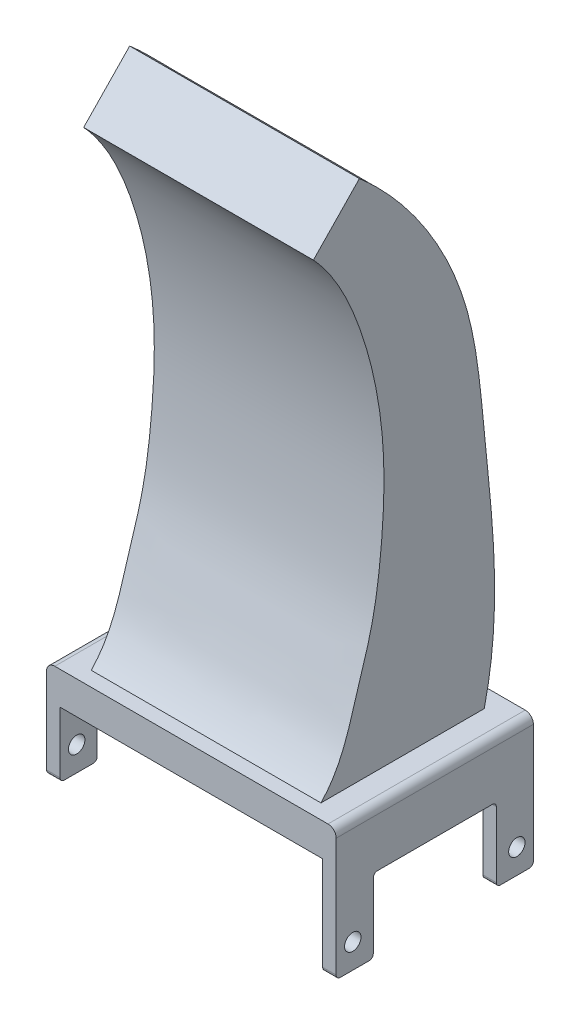
from build123d import *

# Parameters (mm, degrees)
SKETCH1_W                = 35.3
SKETCH1_H                = 24.04
BOSS_EXTRUDE1_DEPTH      = 4
SKETCH2_R                = 1
BOSS_EXTRUDE2_DEPTH      = 1.65
SKETCH3_R                = 1
BOSS_EXTRUDE3_DEPTH      = 1.65
FILLET1_R                = 1
FILLET2_R                = 1
FILLET3_R                = 0.5
BOSS_EXTRUDE4_DEPTH      = 14
BOSS_EXTRUDE4_DEPTH_BACK = 14


with BuildPart() as part:
    # Sketch1 → Boss-Extrude1 (new body)
    with BuildSketch(Plane(origin=(0, 0, 0), x_dir=(1, 0, 0), z_dir=(0, 1, 0))):
        Rectangle(SKETCH1_W, SKETCH1_H)
    extrude(amount=BOSS_EXTRUDE1_DEPTH)

    # Sketch2 → Boss-Extrude2 (add)
    # profile 1 of 2: a face of its own
    with BuildSketch(Plane(origin=(17.65, 0, 0), x_dir=(0, 0, -1), z_dir=(1, 0, 0))):
        Polygon((-7.5, -2.95), (0, -2.95), (0, 0), (-12.02, 0), (-12.02, -11.95), (-7.5, -11.95), align=None)
        with Locations((-10, -8.95)):
            Circle(SKETCH2_R, mode=Mode.SUBTRACT)
    # profile 2 of 2: a face of its own
    with BuildSketch(Plane(origin=(17.65, 0, 0), x_dir=(0, 0, -1), z_dir=(1, 0, 0))):
        Polygon((7.5, -2.95), (7.5, -11.95), (12.02, -11.95), (12.02, 0), (0, 0), (0, -2.95), align=None)
        with Locations((10, -8.95)):
            Circle(SKETCH2_R, mode=Mode.SUBTRACT)
    extrude(amount=-BOSS_EXTRUDE2_DEPTH)

    # Sketch3 → Boss-Extrude3 (add)
    # profile 1 of 2: a face of its own
    with BuildSketch(Plane.ZY.offset(17.65)):
        Polygon((-7.5, -2.95), (0, -2.95), (0, 0), (-12.02, 0), (-12.02, -7.95), (-7.5, -7.95), align=None)
        with Locations((-10, -4.95)):
            Circle(SKETCH3_R, mode=Mode.SUBTRACT)
    # profile 2 of 2: a face of its own
    with BuildSketch(Plane.ZY.offset(17.65)):
        Polygon((7.5, -2.95), (7.5, -7.95), (12.02, -7.95), (12.02, 0), (0, 0), (0, -2.95), align=None)
        with Locations((10, -4.95)):
            Circle(SKETCH3_R, mode=Mode.SUBTRACT)
    extrude(amount=-BOSS_EXTRUDE3_DEPTH)

    # Fillet1
    fillet1_edges = [part.edges().sort_by_distance(p)[0] for p in [
        (17.65, 4, 0),
    ]]
    fillet(fillet1_edges, radius=FILLET1_R)

    # Fillet2
    fillet2_edges = [part.edges().sort_by_distance(p)[0] for p in [
        (-17.65, 4, 0),
    ]]
    fillet(fillet2_edges, radius=FILLET2_R)

    # Fillet3
    fillet3_edges = [part.edges().sort_by_distance(p)[0] for p in [
        (16.825, -2.95, -7.5),
        (16.825, -2.95, 7.5),
        (16.825, -11.95, 7.5),
        (16.825, -11.95, 12.02),
        (16.825, -11.95, -12.02),
        (16.825, -11.95, -7.5),
        (-16.825, -2.95, 7.5),
        (-16.825, -2.95, -7.5),
        (-16.825, -7.95, -7.5),
        (-16.825, -7.95, -12.02),
        (-16.825, -7.95, 12.02),
        (-16.825, -7.95, 7.5),
    ]]
    fillet(fillet3_edges, radius=FILLET3_R)

    # Sketch4 → Boss-Extrude4 (add, two sides: drawn at the far end of the back side and taken through both)
    with BuildSketch(Plane(origin=(0, 0, 0), x_dir=(0, 0, -1), z_dir=(1, 0, 0)).offset(-BOSS_EXTRUDE4_DEPTH_BACK)):
        with BuildLine():
            Line((9.673745494, 4), (-10.226501203, 4))
            add(Edge.make_bspline(
                [(-10.226501203, 4), (-7.796356339, 6.509613533), (-6.336100814, 12.08642199), (-3.780141018, 19.783903225), (-2.777594912, 27.375701916), (-2.332144175, 35.533933475), (-3.204767203, 43.923514345), (-5.6016641, 52.956063732), (-8.540539845, 58.923365351), (-11.151435745, 61.762281392)],
                knots=[0, 0, 0, 0, 0.167475037, 0.276325627, 0.399786563, 0.54187946, 0.677543888, 0.812359313, 1, 1, 1, 1], degree=3))
            Line((-11.151435745, 61.762281392), (-5.544090215, 67.556340911))
            add(Edge.make_bspline(
                [(9.673745494, 4), (11.961149809, 13.645336135), (10.023304181, 27.979049896), (8.188089208, 50.665532333), (0.66732995, 62.181297985), (-5.544090215, 67.556340911)],
                knots=[0, 0, 0, 0, 0.431185056, 0.63430967, 1, 1, 1, 1], degree=3))
        make_face()
    extrude(amount=BOSS_EXTRUDE4_DEPTH + BOSS_EXTRUDE4_DEPTH_BACK)


solid = part.part
